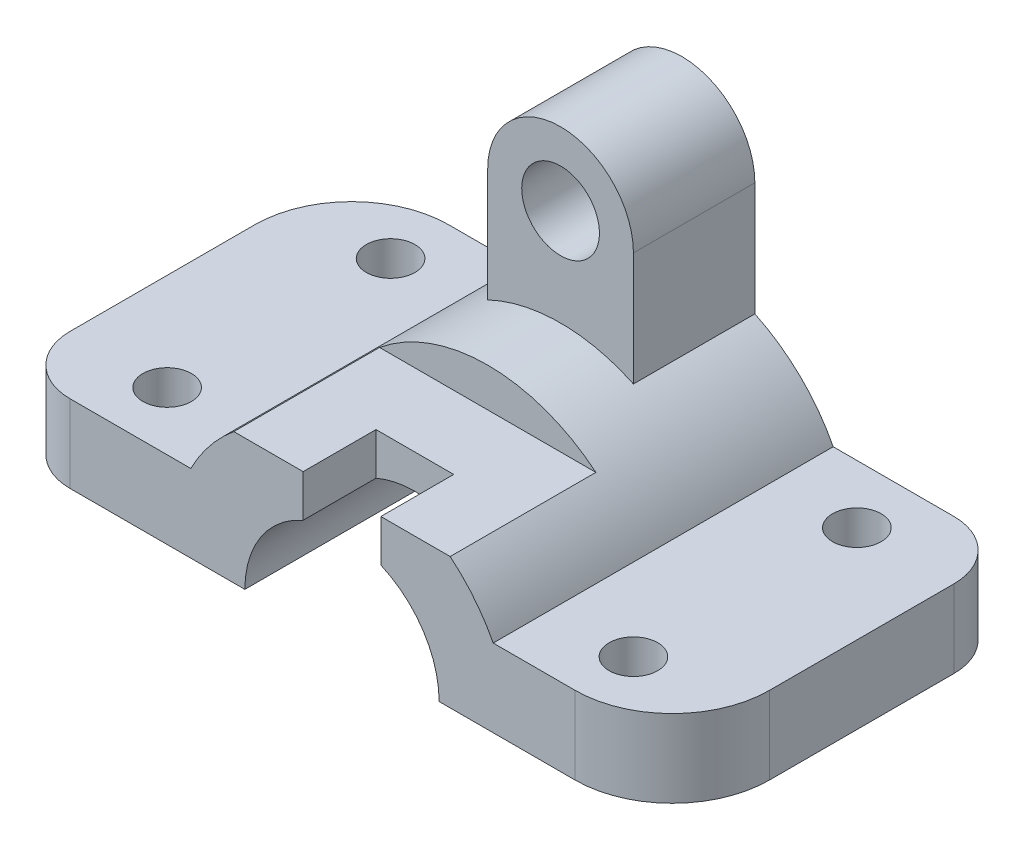
from build123d import *

# Parameters (mm, degrees)
EXTRUDE_1_DEPTH     = 70
CUT_EXTRUDE_2_DEPTH = 30
SKETCH_5_W          = 16
SKETCH_5_H          = 15
CUT_EXTRUDE_3_DEPTH = 102.257098517
EXTRUDE_START       = -25
SKETCH_6_R          = 8
EXTRUDE_2_DEPTH     = 25
SKETCH_7_R          = 5
CUT_EXTRUDE_4_DEPTH = 112.534747949
FILLET_1_R          = 20
FILLET_2_R          = 12


with BuildPart() as part:
    # 草图1 → 凸台-拉伸1 (new body)
    with BuildSketch(Plane.XY):
        with BuildLine():
            ThreePointArc((-20, 0), (0, 20), (20, 0))
            Line((20, 0), (68, 0))
            Line((68, 0), (68, 16))
            Line((68, 16), (31.128764833, 16))
            ThreePointArc((31.128764833, 16), (0, 35), (-31.128764833, 16))
            Line((-31.128764833, 16), (-68, 16))
            Line((-68, 16), (-68, 0))
            Line((-68, 0), (-20, 0))
        make_face()
    extrude(amount=-EXTRUDE_1_DEPTH)

    # 草图1<13> → 切除-拉伸2 (cut)
    with BuildSketch(Plane.XY):
        with BuildLine():
            Line((-22.271057451, 27), (22.271057451, 27))
            ThreePointArc((22.271057451, 27), (0, 35), (-22.271057451, 27))
        make_face()
    extrude(amount=-CUT_EXTRUDE_2_DEPTH, mode=Mode.SUBTRACT)

    # 草图5 → 切除-拉伸3 (cut, through all)
    with BuildSketch(Plane(origin=(0, 27, 0), x_dir=(1, 0, 0), z_dir=(0, 1, 0))):
        with Locations((0, 7.5)):
            Rectangle(SKETCH_5_W, SKETCH_5_H)
    extrude(amount=-CUT_EXTRUDE_3_DEPTH, mode=Mode.SUBTRACT)

    # 草图6 → 凸台-拉伸2 (add)
    with BuildSketch(Plane(origin=(0, 0, -70), x_dir=(-1, 0, 0), z_dir=(0, 0, -1)).offset(EXTRUDE_START)):
        with BuildLine():
            Line((-15, 31.622776602), (-15, 55))
            ThreePointArc((-15, 55), (0, 70), (15, 55))
            Line((15, 55), (15, 31.622776602))
            ThreePointArc((15, 31.622776602), (0, 35), (-15, 31.622776602))
        make_face()
        with Locations((0, 55)):
            Circle(SKETCH_6_R, mode=Mode.SUBTRACT)
    extrude(amount=EXTRUDE_2_DEPTH)

    # 草图7 → 切除-拉伸4 (cut, through all)
    with BuildSketch(Plane(origin=(0, 16, 0), x_dir=(1, 0, 0), z_dir=(0, 1, 0))):
        with Locations((-48, 12)):
            Circle(SKETCH_7_R)
        with Locations((-48, 58)):
            Circle(SKETCH_7_R)
        with Locations((48, 58)):
            Circle(SKETCH_7_R)
        with Locations((48, 12)):
            Circle(SKETCH_7_R)
    extrude(amount=-CUT_EXTRUDE_4_DEPTH, mode=Mode.SUBTRACT)

    # 圆角1
    fillet_1_edges = [part.edges().sort_by_distance(p)[0] for p in [
        (-68, 8, -70),
        (68, 8, 0),
    ]]
    fillet(fillet_1_edges, radius=FILLET_1_R)

    # 圆角2
    fillet_2_edges = [part.edges().sort_by_distance(p)[0] for p in [
        (68, 8, -70),
        (-68, 8, 0),
    ]]
    fillet(fillet_2_edges, radius=FILLET_2_R)


solid = part.part
